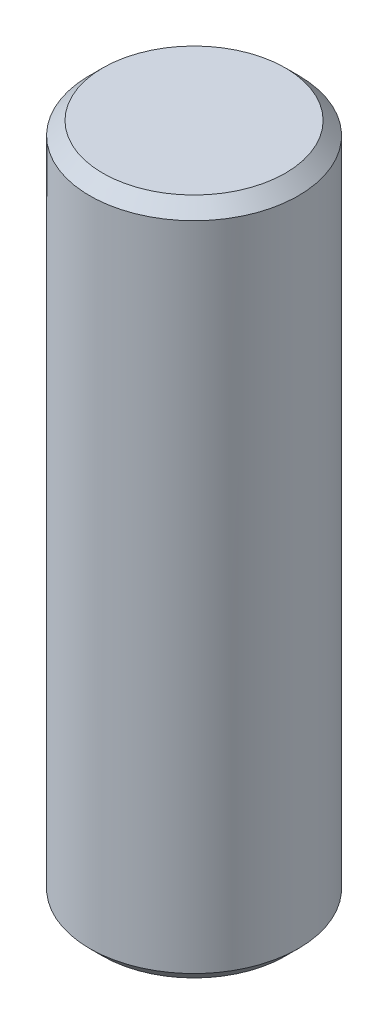
from build123d import *

# Parameters (mm, degrees)
SKETCH1_R           = 8
BOSS_EXTRUDE1_DEPTH = 26
CHAMFER1_SIZE       = 1


with BuildPart() as part:
    # Sketch1 → Boss-Extrude1 (new, symmetric)
    with BuildSketch(Plane(origin=(0, 0, 0), x_dir=(1, 0, 0), z_dir=(0, 1, 0))):
        with Locations(Location((0, 0, 0), (0, 0, 90))):
            Circle(SKETCH1_R)
    extrude(amount=BOSS_EXTRUDE1_DEPTH, both=True)

    # Chamfer1
    chamfer1_edges = [part.edges().sort_by_distance(p)[0] for p in [
        (0, -26, 8),
        (0, 26, 8),
    ]]
    chamfer(chamfer1_edges, length=CHAMFER1_SIZE)


solid = part.part
